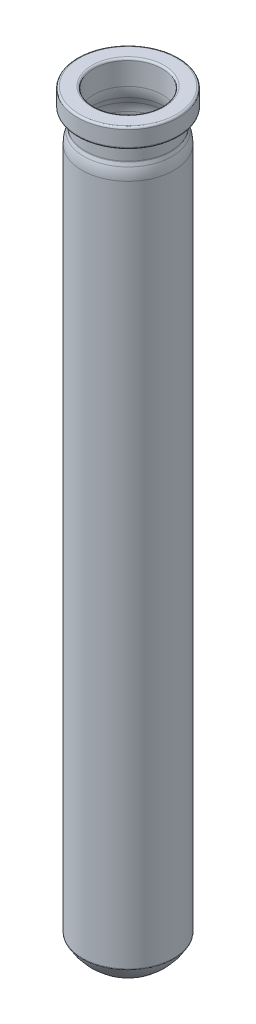
from build123d import *


with BuildPart() as part:
    # Sketch1 → Revolve1 (revolve)
    with BuildSketch(Plane.XY, mode=Mode.PRIVATE) as revolve1_sk:
        with BuildLine():
            Line((-9.017, 5.653790228), (-9.017, 139.493182548))
            ThreePointArc((-9.017, 139.493182548), (-8.920529232, 140.595848476), (-8.634048142, 141.665010458))
            Line((-8.634048142, 141.665010458), (-8.392277111, 142.329270905))
            ThreePointArc((-8.392277111, 142.329270905), (-8.375088246, 142.393420624), (-8.3693, 142.45958058))
            Line((-8.3693, 142.45958058), (-8.3693, 145.1356))
            ThreePointArc((-8.3693, 145.1356), (-8.480892316, 145.405007684), (-8.7503, 145.5166))
            Line((-8.7503, 145.5166), (-9.5377, 145.5166))
            ThreePointArc((-9.5377, 145.5166), (-9.807107684, 145.628192316), (-9.9187, 145.8976))
            Line((-9.9187, 145.8976), (-9.9187, 148.9202))
            ThreePointArc((-9.9187, 148.9202), (-9.807107684, 149.189607684), (-9.5377, 149.3012))
            Line((-9.5377, 149.3012), (-7.0866, 149.3012))
            ThreePointArc((-7.0866, 149.3012), (-6.817192316, 149.189607684), (-6.7056, 148.9202))
            Line((-6.7056, 148.9202), (-6.7056, 144.518352186))
            ThreePointArc((-6.7056, 144.518352186), (-6.802070768, 143.415686257), (-7.088551858, 142.346524275))
            Line((-7.088551858, 142.346524275), (-7.488374899, 141.248019499))
            ThreePointArc((-7.488374899, 141.248019499), (-7.719851619, 140.384136618), (-7.7978, 139.493182548))
            Line((-7.7978, 139.493182548), (-7.7978, 8.412472236))
            ThreePointArc((-7.7978, 8.412472236), (-7.221513837, 5.769230188), (-5.597255583, 3.605756271))
            ThreePointArc((-5.597255583, 3.605756271), (-2.985924448, 2.061290242), (0, 1.524))
            Line((0, 1.524), (0, 0))
            ThreePointArc((0, 0), (-5.257761417, 1.478213913), (-8.974907392, 5.479713293))
            ThreePointArc((-8.974907392, 5.479713293), (-9.006327366, 5.564243359), (-9.017, 5.653790228))
        make_face()
    revolve(revolve1_sk.sketch.rotate(Axis((0, -45.560251793, 0), (0, 1, 0)), 270), axis=Axis((0, -45.560251793, 0), (0, 1, 0)))


solid = part.part
